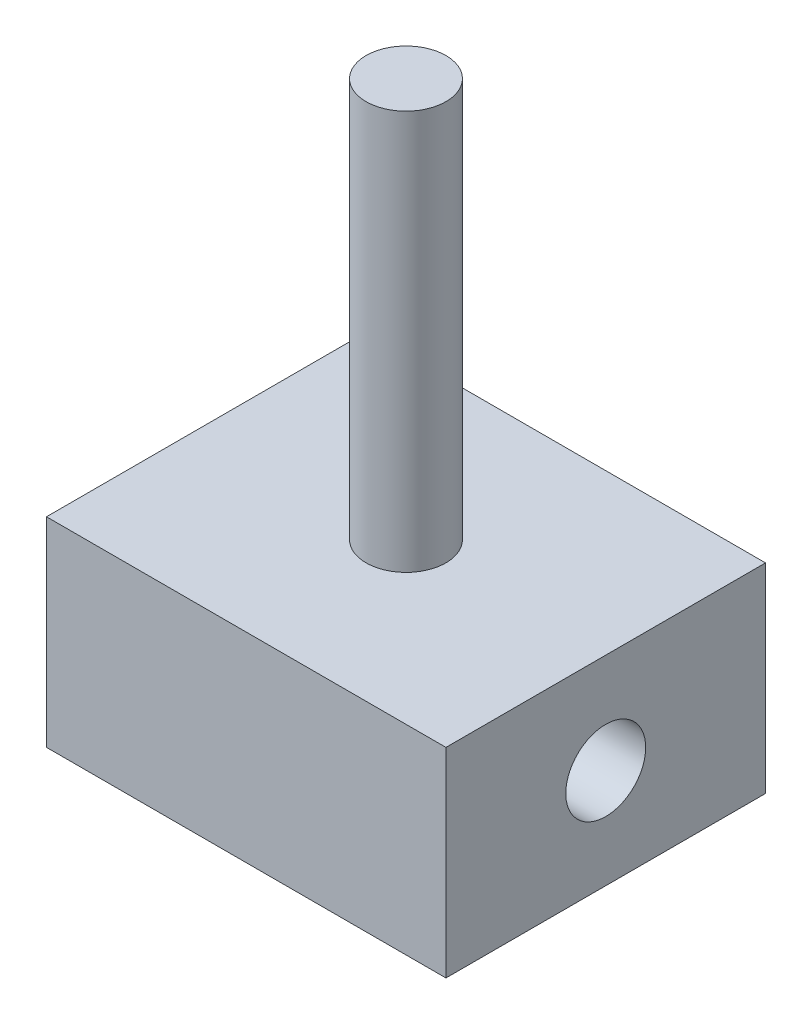
from build123d import *

# Parameters (mm, degrees)
SKETCH1_W           = 50
SKETCH1_H           = 25
BOSS_EXTRUDE1_DEPTH = 20
SKETCH4_R           = 5
BOSS_EXTRUDE2_DEPTH = 50
CUT_EXTRUDE1_DEPTH  = 50


with BuildPart() as part:
    # Sketch1 → Boss-Extrude1 (new, symmetric)
    with BuildSketch(Plane.XY):
        with Locations((0, 12.5)):
            Rectangle(SKETCH1_W, SKETCH1_H)
    extrude(amount=BOSS_EXTRUDE1_DEPTH, both=True)

    # Sketch4 → Boss-Extrude2 (add)
    with BuildSketch(Plane(origin=(0, 25, 0), x_dir=(1, 0, 0), z_dir=(0, 1, 0))):
        with Locations(Location((0, 0, 0), (0, 0, 180))):
            Circle(SKETCH4_R)
    extrude(amount=BOSS_EXTRUDE2_DEPTH)

    # Sketch6 → Cut-Extrude1 (cut)
    with BuildSketch(Plane(origin=(25, 0, 0), x_dir=(0, 0, -1), z_dir=(1, 0, 0))):
        with BuildLine():
            ThreePointArc((5, 12.5), (3.535533906, 16.035533906), (0, 17.5))
            Line((0, 17.5), (0, 7.5))
            ThreePointArc((0, 7.5), (3.535533906, 8.964466094), (5, 12.5))
        make_face()
        with BuildLine():
            Line((0, 7.5), (0, 17.5))
            ThreePointArc((0, 17.5), (-5, 12.5), (0, 7.5))
        make_face()
    extrude(amount=-CUT_EXTRUDE1_DEPTH, mode=Mode.SUBTRACT)


solid = part.part
